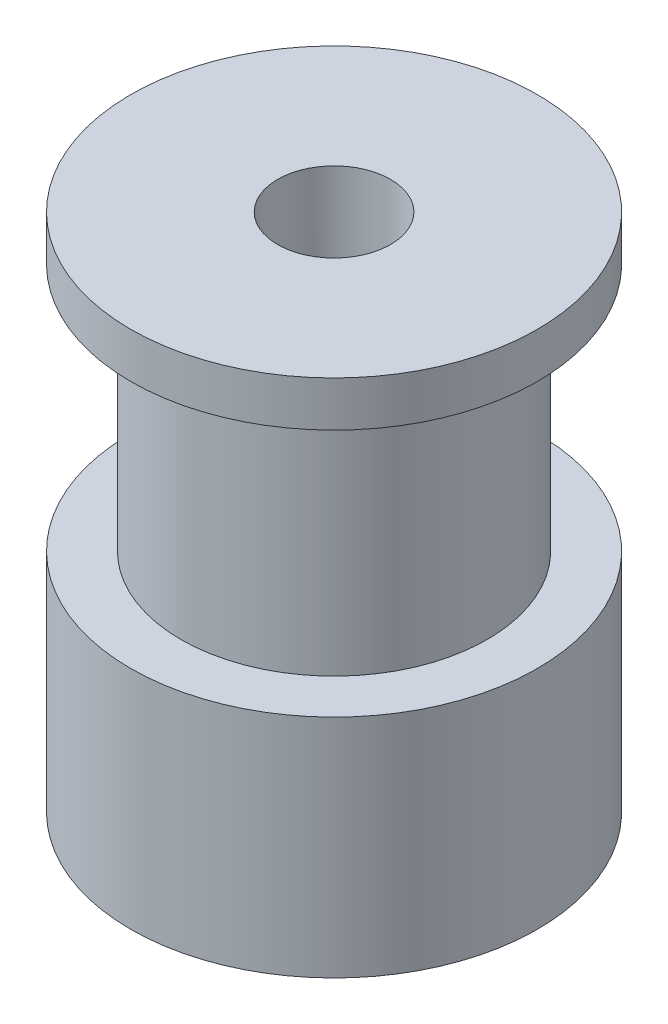
from build123d import *

# Parameters (mm, degrees)
SKETCH_1_R          = 9
EXTRUDE_1_DEPTH     = 10
SKETCH_2_R          = 6.78
EXTRUDE_2_DEPTH     = 11
SKETCH_3_R          = 9
EXTRUDE_3_DEPTH     = 2
SKETCH_5_R          = 2.5
CUT_EXTRUDE_1_DEPTH = 27.286878856
SKETCH_6_R          = 1.5
CUT_EXTRUDE_2_DEPTH = 27.286878856
SKETCH_7_R          = 1.5
CUT_EXTRUDE_3_DEPTH = 27.286879012


with BuildPart() as part:
    # 草图1 → 凸台-拉伸1 (new body)
    with BuildSketch(Plane(origin=(0, 0, 0), x_dir=(1, 0, 0), z_dir=(0, 1, 0))):
        with Locations(Location((0, 0, 0), (0, 0, 270))):
            Circle(SKETCH_1_R)
    extrude(amount=EXTRUDE_1_DEPTH)

    # 草图2 → 凸台-拉伸2 (add)
    with BuildSketch(Plane(origin=(0, 10, 0), x_dir=(1, 0, 0), z_dir=(0, 1, 0))):
        with Locations(Location((0, 0, 0), (0, 0, 270))):
            Circle(SKETCH_2_R)
    extrude(amount=EXTRUDE_2_DEPTH)

    # 草图3 → 凸台-拉伸3 (add)
    with BuildSketch(Plane(origin=(0, 21, 0), x_dir=(1, 0, 0), z_dir=(0, 1, 0))):
        with Locations(Location((0, 0, 0), (0, 0, 270))):
            Circle(SKETCH_3_R)
    extrude(amount=EXTRUDE_3_DEPTH)

    # 草图5 → 切除-拉伸1 (cut, through all)
    with BuildSketch(Plane.XZ):
        with Locations(Location((0, 0, 0), (0, 0, 270))):
            Circle(SKETCH_5_R)
    extrude(amount=-CUT_EXTRUDE_1_DEPTH, mode=Mode.SUBTRACT)

    # 草图6 → 切除-拉伸2 (cut, through all)
    with BuildSketch(Plane.XY):
        with Locations(Location((0, 6, 0), (0, 0, 90))):
            Circle(SKETCH_6_R)
    extrude(amount=-CUT_EXTRUDE_2_DEPTH, mode=Mode.SUBTRACT)

    # 草图7 → 切除-拉伸3 (cut, through all)
    with BuildSketch(Plane(origin=(0, 0, 0), x_dir=(0, 0, -1), z_dir=(1, 0, 0))):
        with Locations((0, 6)):
            Circle(SKETCH_7_R)
    extrude(amount=-CUT_EXTRUDE_3_DEPTH, mode=Mode.SUBTRACT)


solid = part.part
